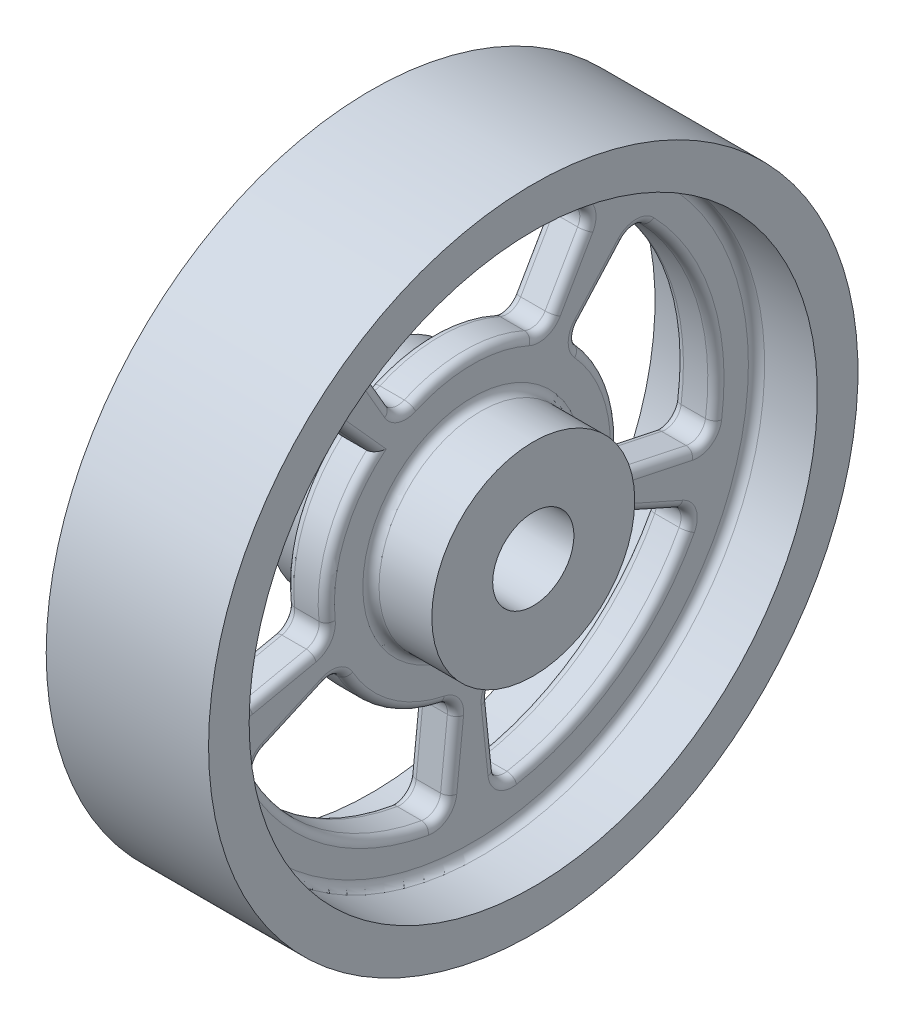
from build123d import *

# Parameters (mm, degrees)
CUT_EXTRUDE1_DEPTH       = 10
FILLET1_R                = 2
FILLET2_R                = 2
FILLET3_R                = 2
FILLET4_R                = 2
CIRPATTERN2_COUNT        = 5
FILLET1_OF_CIRPATTERN2_R = 2
FILLET2_OF_CIRPATTERN2_R = 2
FILLET3_OF_CIRPATTERN2_R = 2
FILLET5_R                = 2
FILLET6_R                = 2
FILLET7_R                = 2
FILLET8_R                = 1
FILLET9_R                = 1


with BuildPart() as part:
    # Sketch2 → Revolve8 (revolve)
    with BuildSketch(Plane.XY, mode=Mode.PRIVATE) as revolve8_sk:
        Polygon((2.5, 35), (10, 35), (10, 40), (-10, 40), (-10, 35), (-2.5, 35), (-2.5, 12.5), (-10, 12.5), (-10, 5), (10, 5), (10, 12.5), (2.5, 12.5), align=None)
    revolve(revolve8_sk.sketch.rotate(Axis((0, 0, 0), (1, 0, 0)), 90), axis=Axis((0, 0, 0), (1, 0, 0)))

    # Sketch5 → Cut-Extrude1 (cut)
    with BuildSketch(Plane(origin=(2.5, 0, 0), x_dir=(0, 0, -1), z_dir=(1, 0, 0))):
        with BuildLine():
            Line((9, 15.588457268), (15, 25.980762114))
            ThreePointArc((15, 25.980762114), (0, 30), (-15, 25.980762114))
            Line((-15, 25.980762114), (-9, 15.588457268))
            ThreePointArc((-9, 15.588457268), (0, 18), (9, 15.588457268))
        make_face()
    cut_extrude1 = extrude(amount=-CUT_EXTRUDE1_DEPTH, mode=Mode.SUBTRACT)

    # Fillet1
    fillet1_edges = [part.edges().sort_by_distance(p)[0] for p in [
        (0, 25.980762114, 15),
    ]]
    fillet(fillet1_edges, radius=FILLET1_R)

    # Fillet2
    fillet2_edges = [part.edges().sort_by_distance(p)[0] for p in [
        (0, 25.980762114, -15),
    ]]
    fillet(fillet2_edges, radius=FILLET2_R)

    # Fillet3
    fillet3_edges = [part.edges().sort_by_distance(p)[0] for p in [
        (0, 15.588457268, 9),
    ]]
    fillet(fillet3_edges, radius=FILLET3_R)

    # Fillet4
    fillet4_edges = [part.edges().sort_by_distance(p)[0] for p in [
        (0, 15.588457268, -9),
    ]]
    fillet(fillet4_edges, radius=FILLET4_R)

    # CirPattern2: Cut-Extrude1 ×5 about axis
    cirpattern2_axis = Axis((0, 0, 0), (1, 0, 0))
    for i in range(1, CIRPATTERN2_COUNT):
        add(cut_extrude1.rotate(cirpattern2_axis, i * 360 / CIRPATTERN2_COUNT), mode=Mode.SUBTRACT)

    # Fillet1 of CirPattern2
    fillet1_of_cirpattern2_edges = [part.edges().sort_by_distance(p)[0] for p in [
        (0, -6.237350725, 29.344428022),
        (0, -29.835656861, 3.135853898),
        (0, -12.202099292, -27.406363729),
        (0, 22.294344764, -20.073918191),
    ]]
    fillet(fillet1_of_cirpattern2_edges, radius=FILLET1_OF_CIRPATTERN2_R)

    # Fillet2 of CirPattern2
    fillet2_of_cirpattern2_edges = [part.edges().sort_by_distance(p)[0] for p in [
        (0, 22.294344764, 20.073918191),
        (0, -12.202099292, 27.406363729),
        (0, -29.835656861, -3.135853898),
        (0, -6.237350725, -29.344428022),
    ]]
    fillet(fillet2_of_cirpattern2_edges, radius=FILLET2_OF_CIRPATTERN2_R)

    # Fillet3 of CirPattern2
    fillet3_of_cirpattern2_edges = [part.edges().sort_by_distance(p)[0] for p in [
        (0, -3.742410435, 17.606656813),
        (0, -17.901394117, 1.881512339),
        (0, -7.321259575, -16.443818238),
        (0, 13.376606859, -12.044350914),
    ]]
    fillet(fillet3_of_cirpattern2_edges, radius=FILLET3_OF_CIRPATTERN2_R)

    # Fillet5
    fillet5_edges = [part.edges().sort_by_distance(p)[0] for p in [
        (0, -3.742410435, -17.606656813),
    ]]
    fillet(fillet5_edges, radius=FILLET5_R)

    # Fillet6
    fillet6_edges = [part.edges().sort_by_distance(p)[0] for p in [
        (0, -17.901394117, -1.881512339),
    ]]
    fillet(fillet6_edges, radius=FILLET6_R)

    # Fillet7
    fillet7_edges = [part.edges().sort_by_distance(p)[0] for p in [
        (0, -7.321259575, 16.443818238),
    ]]
    fillet(fillet7_edges, radius=FILLET7_R)

    # Fillet8
    fillet8_edges = [part.edges().sort_by_distance(p)[0] for p in [
        (2.5, 17.06575616, 15.366075865),
        (2.5, 0, -35),
        (2.5, 0, -12.5),
        (2.5, 17.771650383, -16.001665879),
        (2.5, 21.416368191, -20.14086169),
        (2.5, -9.726746619, -21.846630597),
        (2.5, -12.537076026, -26.592045067),
        (2.5, -23.783110394, 2.49970563),
        (2.5, -29.164707294, 3.706074009),
        (2.5, -4.972023962, 23.391533639),
        (2.5, -5.487704354, 28.882524769),
        (2.5, 9.270509831, -28.531695489),
        (2.5, -5.487704354, -28.882524769),
        (2.5, -24.270509831, -17.633557569),
        (2.5, -29.164707294, -3.706074009),
        (2.5, -24.270509831, 17.633557569),
        (2.5, -12.537076026, 26.592045067),
        (2.5, 9.270509831, 28.531695489),
        (2.5, 21.416368191, 20.14086169),
        (2.5, 5.562305899, -17.119017293),
        (2.5, 13.445581763, -12.801825774),
        (2.5, -14.562305899, -10.580134541),
        (2.5, -8.020346559, -16.743489875),
        (2.5, -14.562305899, 10.580134541),
        (2.5, -18.402428538, 2.453779941),
        (2.5, 6.412356686, 16.819086828),
        (2.5, -3.352979753, 18.260009279),
        (2.5, -4.972023962, -23.391533639),
        (2.5, -3.352979753, -18.260009279),
        (2.5, -23.783110394, -2.49970563),
        (2.5, -18.402428538, -2.453779941),
        (2.5, -9.726746619, 21.846630597),
        (2.5, -8.020346559, 16.743489875),
        (2.5, 20.710230592, 11.957057207),
        (2.5, 25.773119483, 14.14430798),
        (2.5, 30, 0),
        (2.5, 25.773119483, -14.14430798),
        (2.5, 18, 0),
        (2.5, 16.330173087, 8.831526428),
        (2.5, 20.710230592, -11.957057207),
        (2.5, 16.330173087, -8.831526428),
    ]]
    fillet(fillet8_edges, radius=FILLET8_R)

    # Fillet9
    fillet9_edges = [part.edges().sort_by_distance(p)[0] for p in [
        (-2.5, 0, -12.5),
        (-2.5, 0, -35),
        (-2.5, 17.771650383, -16.001665879),
        (-2.5, 21.416368191, -20.14086169),
        (-2.5, -9.726746619, -21.846630597),
        (-2.5, -12.537076026, -26.592045067),
        (-2.5, -23.783110394, 2.49970563),
        (-2.5, -29.164707294, 3.706074009),
        (-2.5, -4.972023962, 23.391533639),
        (-2.5, -5.487704354, 28.882524769),
        (-2.5, 9.270509831, -28.531695489),
        (-2.5, -5.487704354, -28.882524769),
        (-2.5, -24.270509831, -17.633557569),
        (-2.5, -29.164707294, -3.706074009),
        (-2.5, -24.270509831, 17.633557569),
        (-2.5, -12.537076026, 26.592045067),
        (-2.5, 9.270509831, 28.531695489),
        (-2.5, 21.416368191, 20.14086169),
        (-2.5, 5.562305899, -17.119017293),
        (-2.5, 13.445581763, -12.801825774),
        (-2.5, -14.562305899, -10.580134541),
        (-2.5, -8.020346559, -16.743489875),
        (-2.5, -14.562305899, 10.580134541),
        (-2.5, -18.402428538, 2.453779941),
        (-2.5, 6.412356686, 16.819086828),
        (-2.5, -3.352979753, 18.260009279),
        (-2.5, -4.972023962, -23.391533639),
        (-2.5, -3.352979753, -18.260009279),
        (-2.5, -23.783110394, -2.49970563),
        (-2.5, -18.402428538, -2.453779941),
        (-2.5, -9.726746619, 21.846630597),
        (-2.5, -8.020346559, 16.743489875),
        (-2.5, 20.710230592, 11.957057207),
        (-2.5, 25.773119483, 14.14430798),
        (-2.5, 30, 0),
        (-2.5, 25.773119483, -14.14430798),
        (-2.5, 18, 0),
        (-2.5, 16.330173087, 8.831526428),
        (-2.5, 20.710230592, -11.957057207),
        (-2.5, 16.330173087, -8.831526428),
        (-2.5, 17.06575616, 15.366075865),
    ]]
    fillet(fillet9_edges, radius=FILLET9_R)


solid = part.part
